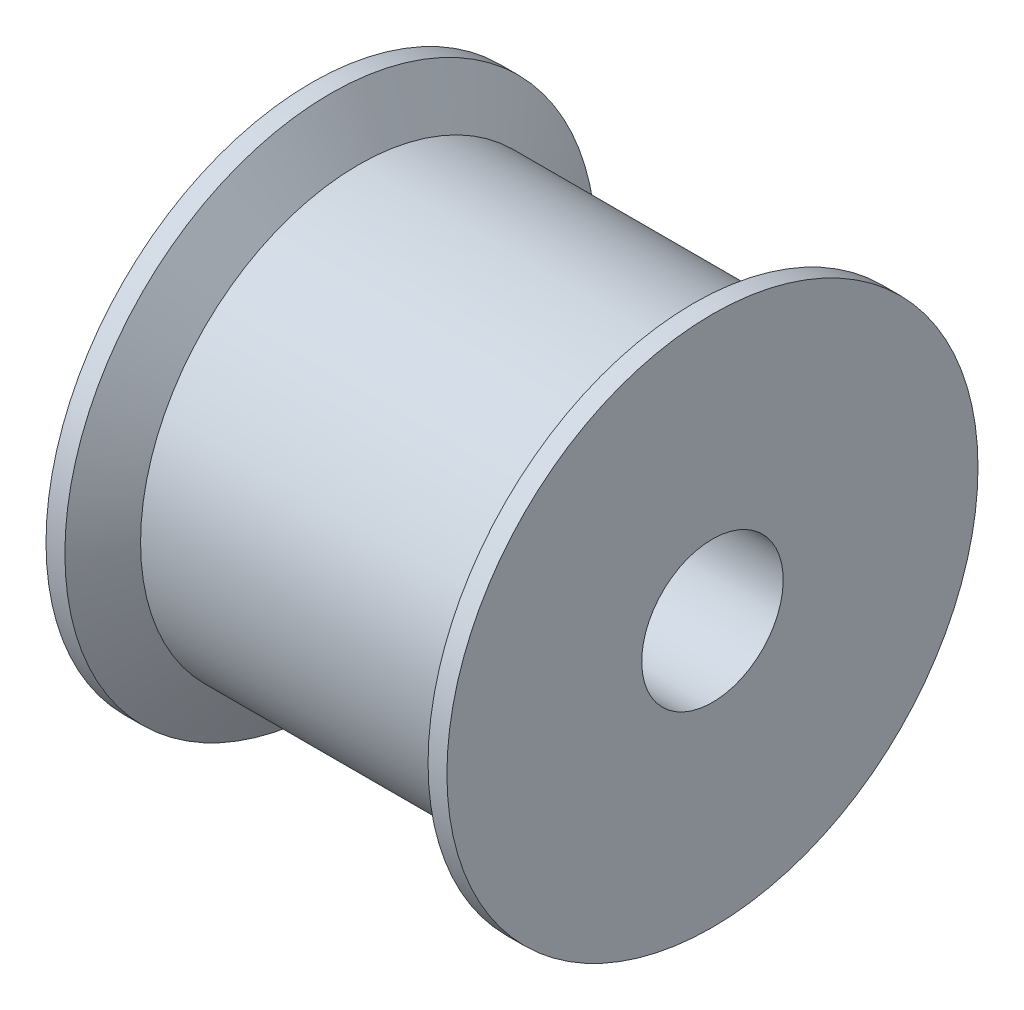
from build123d import *


with BuildPart() as part:
    # Sketch1 → Revolve1 (revolve)
    with BuildSketch(Plane.XY):
        Polygon((-8.5, 0.60523395), (0, 0.60523395), (0, 4.73523395), (-0.4, 4.73523395), (-1, 3.73023395), (-7.5, 3.73023395), (-8.1, 4.73523395), (-8.5, 4.73523395), align=None)
    revolve(axis=Axis((10.310000758, -0.89476605, 0), (-1, 0, 0)))


solid = part.part
